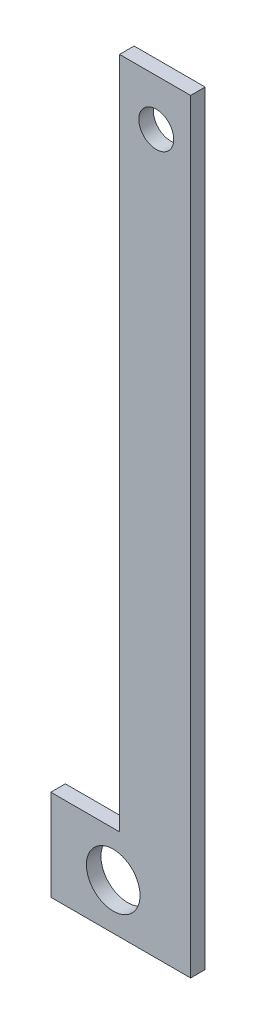
from build123d import *

# Parameters (mm, degrees)
SKETCH1_R           = 5.536921134
SKETCH1_R_2         = 3.604124075
BOSS_EXTRUDE1_DEPTH = 3


with BuildPart() as part:
    # Sketch1 → Boss-Extrude1 (new body)
    with BuildSketch(Plane.XY):
        Polygon((18.346489636, -17.887190203), (3.666166363, -17.887190203), (3.666166363, -156.940093395), (-10.526671527, -156.940093395), (-10.526671527, -175.733774116), (3.666166363, -175.733774116), (18.346489636, -175.733774116), (18.346489636, -156.940093395), align=None)
        with Locations((2.357231156, -166.225505799)):
            Circle(SKETCH1_R, mode=Mode.SUBTRACT)
        with Locations((11.25, -27.5)):
            Circle(SKETCH1_R_2, mode=Mode.SUBTRACT)
    extrude(amount=BOSS_EXTRUDE1_DEPTH)


solid = part.part
